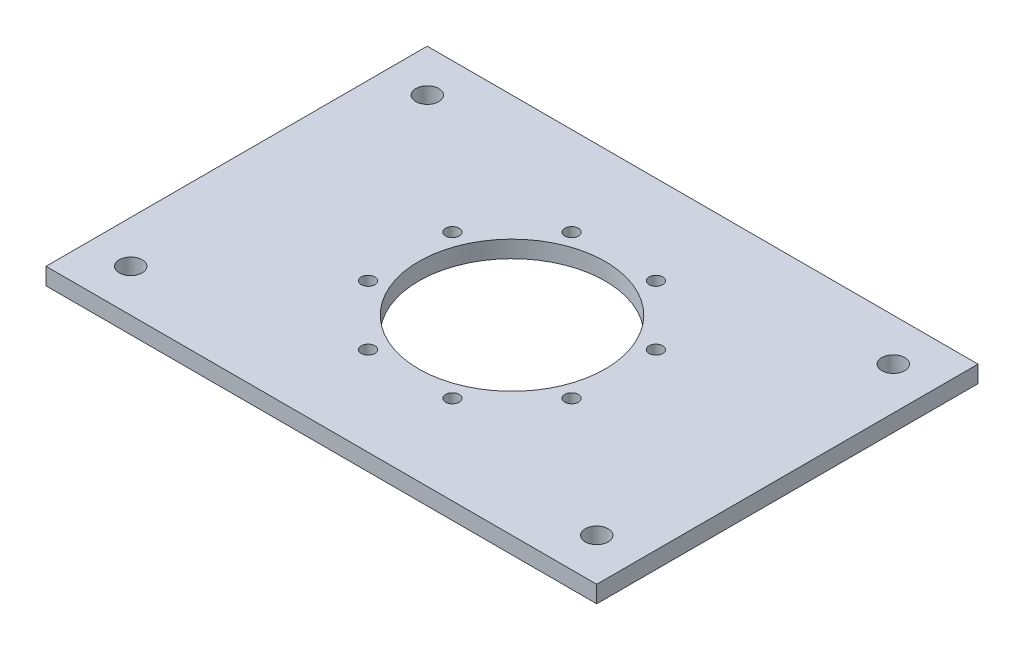
from build123d import *

# Parameters (mm, degrees)
SKETCH1_W           = 325
SKETCH1_H           = 225
SKETCH1_R           = 55
BOSS_EXTRUDE1_DEPTH = 10
SKETCH2_R           = 4
CUT_EXTRUDE1_DEPTH  = 10
CUT_EXTRUDE2_REACH  = 199.895
SKETCH4_R           = 6.75


with BuildPart() as part:
    # Sketch1 → Boss-Extrude1 (new body)
    with BuildSketch(Plane(origin=(0, 0, 0), x_dir=(1, 0, 0), z_dir=(0, 1, 0))):
        Rectangle(SKETCH1_W, SKETCH1_H)
        with Locations(Location((0, 0, 0), (0, 0, 270))):
            Circle(SKETCH1_R, mode=Mode.SUBTRACT)
    extrude(amount=BOSS_EXTRUDE1_DEPTH)

    # Sketch2 → Cut-Extrude1 (cut)
    with BuildSketch(Plane(origin=(0, 0, 0), x_dir=(1, 0, 0), z_dir=(0, 1, 0))):
        with Locations(Location((-24.874423104, -60.052169613, 0), (0, 0, 270))):
            Circle(SKETCH2_R)
        with Locations(Location((-60.052169613, -24.874423104, 0), (0, 0, 270))):
            Circle(SKETCH2_R)
        with Locations(Location((-60.052169613, 24.874423104, 0), (0, 0, 270))):
            Circle(SKETCH2_R)
        with Locations(Location((-24.874423104, 60.052169613, 0), (0, 0, 270))):
            Circle(SKETCH2_R)
        with Locations(Location((24.874423104, 60.052169613, 0), (0, 0, 270))):
            Circle(SKETCH2_R)
        with Locations(Location((60.052169613, 24.874423104, 0), (0, 0, 270))):
            Circle(SKETCH2_R)
        with Locations(Location((60.052169613, -24.874423104, 0), (0, 0, 270))):
            Circle(SKETCH2_R)
        with Locations(Location((24.874423104, -60.052169613, 0), (0, 0, 270))):
            Circle(SKETCH2_R)
    extrude(amount=CUT_EXTRUDE1_DEPTH, mode=Mode.SUBTRACT)

    # Sketch4 → Cut-Extrude2 (cut, up to next)
    with BuildSketch(Plane(origin=(0, 0, 0), x_dir=(1, 0, 0), z_dir=(0, 1, 0)), mode=Mode.PRIVATE) as cut_extrude2_sk1:
        with Locations(Location((137.5, 87.5, 0), (0, 0, 90))):
            Circle(SKETCH4_R)
    cut_extrude2_tool1 = extrude(cut_extrude2_sk1.sketch, amount=CUT_EXTRUDE2_REACH, mode=Mode.PRIVATE) & part.part
    # Sketch4 → Cut-Extrude2 (cut, up to next)
    with BuildSketch(Plane(origin=(0, 0, 0), x_dir=(1, 0, 0), z_dir=(0, 1, 0)), mode=Mode.PRIVATE) as cut_extrude2_sk2:
        with Locations(Location((-137.5, 87.5, 0), (0, 0, 90))):
            Circle(SKETCH4_R)
    cut_extrude2_tool2 = extrude(cut_extrude2_sk2.sketch, amount=CUT_EXTRUDE2_REACH, mode=Mode.PRIVATE) & part.part
    # Sketch4 → Cut-Extrude2 (cut, up to next)
    with BuildSketch(Plane(origin=(0, 0, 0), x_dir=(1, 0, 0), z_dir=(0, 1, 0)), mode=Mode.PRIVATE) as cut_extrude2_sk3:
        with Locations(Location((-137.5, -87.5, 0), (0, 0, 90))):
            Circle(SKETCH4_R)
    cut_extrude2_tool3 = extrude(cut_extrude2_sk3.sketch, amount=CUT_EXTRUDE2_REACH, mode=Mode.PRIVATE) & part.part
    # Sketch4 → Cut-Extrude2 (cut, up to next)
    with BuildSketch(Plane(origin=(0, 0, 0), x_dir=(1, 0, 0), z_dir=(0, 1, 0)), mode=Mode.PRIVATE) as cut_extrude2_sk4:
        with Locations(Location((137.5, -87.5, 0), (0, 0, 90))):
            Circle(SKETCH4_R)
    cut_extrude2_tool4 = extrude(cut_extrude2_sk4.sketch, amount=CUT_EXTRUDE2_REACH, mode=Mode.PRIVATE) & part.part
    add(cut_extrude2_tool1.solids().sort_by_distance((137.5, 0, -87.5))[0], mode=Mode.SUBTRACT)
    add(cut_extrude2_tool2.solids().sort_by_distance((-137.5, 0, -87.5))[0], mode=Mode.SUBTRACT)
    add(cut_extrude2_tool3.solids().sort_by_distance((-137.5, 0, 87.5))[0], mode=Mode.SUBTRACT)
    add(cut_extrude2_tool4.solids().sort_by_distance((137.5, 0, 87.5))[0], mode=Mode.SUBTRACT)


solid = part.part
